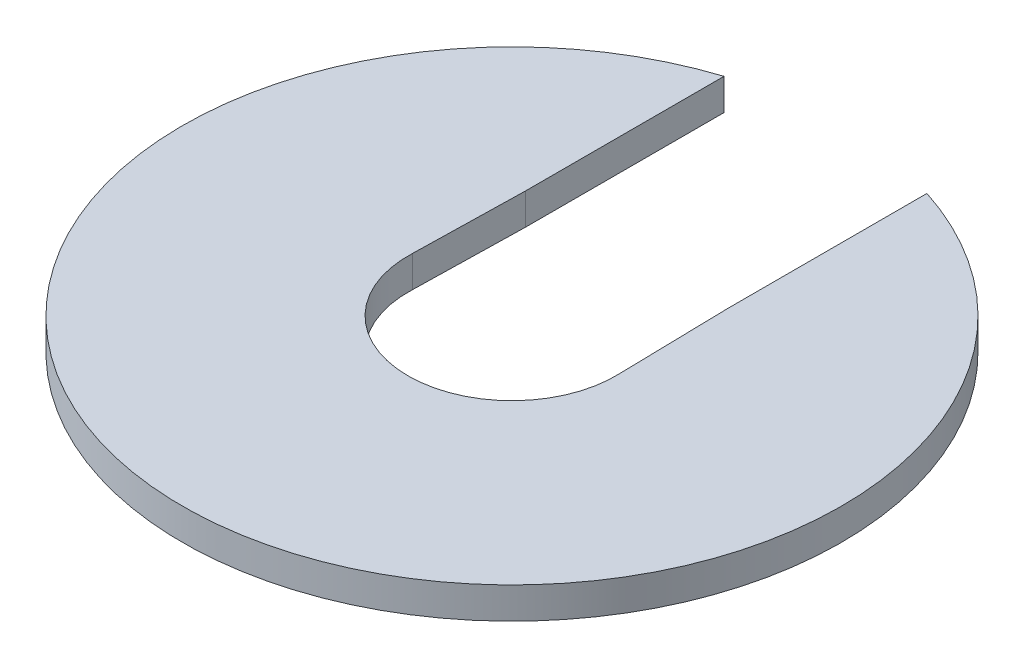
from build123d import *

# Parameters (mm, degrees)
BOSS_EXTRUDE1_DEPTH = 3.175


with BuildPart() as part:
    # Sketch1 → Boss-Extrude1 (new body)
    with BuildSketch(Plane(origin=(0, 0, 0), x_dir=(1, 0, 0), z_dir=(0, 1, 0))):
        with BuildLine():
            Line((-10.25, 11.6), (-10.25, 31.683236893))
            ThreePointArc((-10.25, 31.683236893), (-19.590367531, -26.927820187), (33.3, 0))
            ThreePointArc((33.3, 0), (26.927820187, 19.590367531), (10.25, 31.683236893))
            Line((10.25, 31.683236893), (10.25, 11.6))
            Line((10.25, 11.6), (10.490250515, 0.452376089))
            ThreePointArc((10.490250515, 0.452376089), (10.497562346, 0.226240568), (10.5, 0))
            ThreePointArc((10.5, 0), (0, -10.5), (-10.5, 0))
            ThreePointArc((-10.5, 0), (-10.497562346, 0.226240568), (-10.490250515, 0.452376089))
            Line((-10.490250515, 0.452376089), (-10.25, 11.6))
        make_face()
    extrude(amount=BOSS_EXTRUDE1_DEPTH)


solid = part.part
